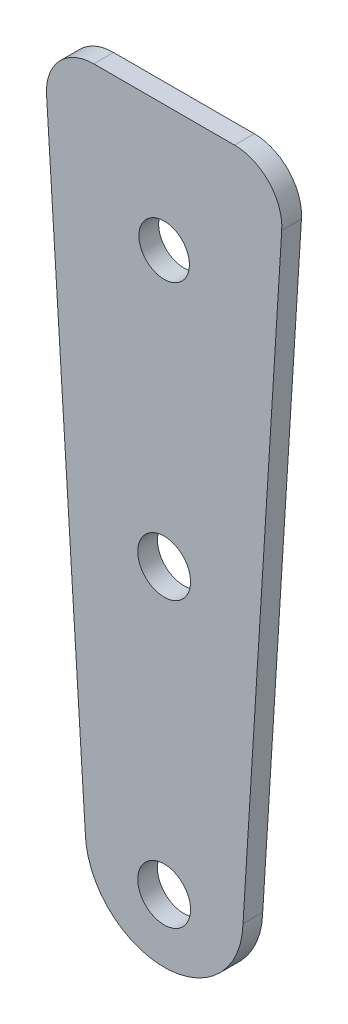
from build123d import *

# Parameters (mm, degrees)
BOSS_EXTRUDE1_DEPTH      = 76.2
BOSS_EXTRUDE1_DEPTH_BACK = 76.2
CUT_EXTRUDE1_DEPTH       = 136.619651209
CUT_EXTRUDE1_DEPTH_BACK  = 136.619651209
FILLET1_R                = 3.81
SKETCH14_R               = 2.032
CUT_EXTRUDE8_DEPTH       = 156.372005628
CUT_EXTRUDE9_DEPTH       = 136.355460931
CUT_EXTRUDE9_DEPTH_BACK  = 136.355460931
SKETCH15_W               = 96.731852598
SKETCH15_H               = 147.433285995
SKETCH15_W_2             = 126.258869859
SKETCH15_H_2             = 31.294033563
CUT_EXTRUDE10_DEPTH      = 112.88020808
CUT_EXTRUDE10_DEPTH_BACK = 112.88020808
SKETCH16_R               = 2.127


with BuildPart() as part:
    # Sketch1 → Boss-Extrude1 (new, two sides: drawn at the far end of the back side and taken through both)
    with BuildSketch(Plane.XY.offset(-BOSS_EXTRUDE1_DEPTH_BACK)):
        with BuildLine():
            Line((-6.335258536, -105.245804705), (-12.685258536, -3.645804705))
            ThreePointArc((-12.685258536, -3.645804705), (0.014741464, 8.866413132), (12.714741464, -3.645804705))
            Line((12.714741464, -3.645804705), (6.364741464, -105.245804705))
            ThreePointArc((6.364741464, -105.245804705), (0.014741464, -111.465623147), (-6.335258536, -105.245804705))
        make_face()
    extrude(amount=BOSS_EXTRUDE1_DEPTH + BOSS_EXTRUDE1_DEPTH_BACK)

    # Sketch4 → Cut-Extrude1 (cut, two sides: drawn at the far end of the back side and taken through both)
    with BuildSketch(Plane(origin=(0, 0, 0), x_dir=(0, 0, -1), z_dir=(1, 0, 0)).offset(-CUT_EXTRUDE1_DEPTH_BACK)):
        Polygon((-47.498, -73.524605007), (-47.498, -51.299605007), (47.625, -51.299605007), (47.625, -73.524605007), (76.2, -73.524605007), (76.2, 8.866413132), (-76.2, 8.866413132), (-76.2, -28.682279346), (-76.2, -111.465623147), (-60.198, -111.465623147), (-60.198, -73.524605007), align=None)
    extrude(amount=CUT_EXTRUDE1_DEPTH + CUT_EXTRUDE1_DEPTH_BACK, mode=Mode.SUBTRACT)

    # Fillet1
    fillet1_edges = [part.edges().sort_by_distance(p)[0] for p in [
        (8.347316445, -73.524605007, 53.848),
        (9.736378945, -51.299605007, -0.0635),
        (-8.317833517, -73.524605007, 53.848),
        (-9.706896017, -51.299605007, -0.0635),
        (8.347316445, -73.524605007, -61.9125),
        (-8.317833517, -73.524605007, -61.9125),
    ]]
    fillet(fillet1_edges, radius=FILLET1_R)

    # Sketch14 → Cut-Extrude8 (cut, through all)
    with BuildSketch(Plane(origin=(0, 0, -47.625), x_dir=(-1, 0, 0), z_dir=(0, 0, -1))):
        with Locations((-0.014741464, -61.459605007)):
            Circle(SKETCH14_R)
    extrude(amount=-CUT_EXTRUDE8_DEPTH, mode=Mode.SUBTRACT)

    # Sketch15 → Cut-Extrude9 (cut, two sides: drawn at the far end of the back side and taken through both)
    with BuildSketch(Plane(origin=(0, 0, 0), x_dir=(1, 0, 0), z_dir=(0, 1, 0)).offset(-CUT_EXTRUDE9_DEPTH_BACK)):
        with Locations((-16.666713659, 27.806142998)):
            Rectangle(SKETCH15_W, SKETCH15_H)
        with Locations((-1.903205029, -63.145016782)):
            Rectangle(SKETCH15_W_2, SKETCH15_H_2)
    extrude(amount=CUT_EXTRUDE9_DEPTH + CUT_EXTRUDE9_DEPTH_BACK, mode=Mode.SUBTRACT)

    # Sketch16 → Cut-Extrude10 (cut, two sides: drawn at the far end of the back side and taken through both)
    with BuildSketch(Plane.XY.offset(47.498).offset(-CUT_EXTRUDE10_DEPTH_BACK)):
        with Locations((0.014741464, -106.385623147)):
            Circle(SKETCH16_R)
        with Locations((0.014741464, -83.525623147)):
            Circle(SKETCH16_R)
    extrude(amount=CUT_EXTRUDE10_DEPTH + CUT_EXTRUDE10_DEPTH_BACK, mode=Mode.SUBTRACT)


solid = part.part
